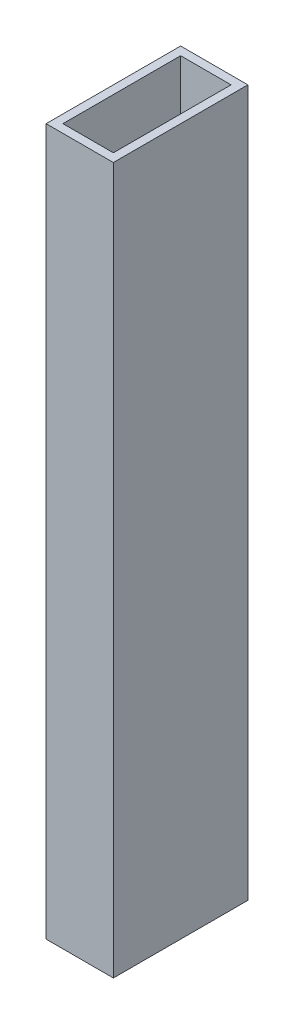
from build123d import *

# Parameters (mm, degrees)
SKETCH1_W           = 25.4
SKETCH1_H           = 50.8
SKETCH1_W_2         = 19.05
SKETCH1_H_2         = 44.45
BOSS_EXTRUDE1_DEPTH = 266.7


with BuildPart() as part:
    # Sketch1 → Boss-Extrude1 (new body)
    with BuildSketch(Plane(origin=(0, 0, 0), x_dir=(1, 0, 0), z_dir=(0, 1, 0))):
        Rectangle(SKETCH1_W, SKETCH1_H)
        Rectangle(SKETCH1_W_2, SKETCH1_H_2, mode=Mode.SUBTRACT)
    extrude(amount=BOSS_EXTRUDE1_DEPTH)


solid = part.part
